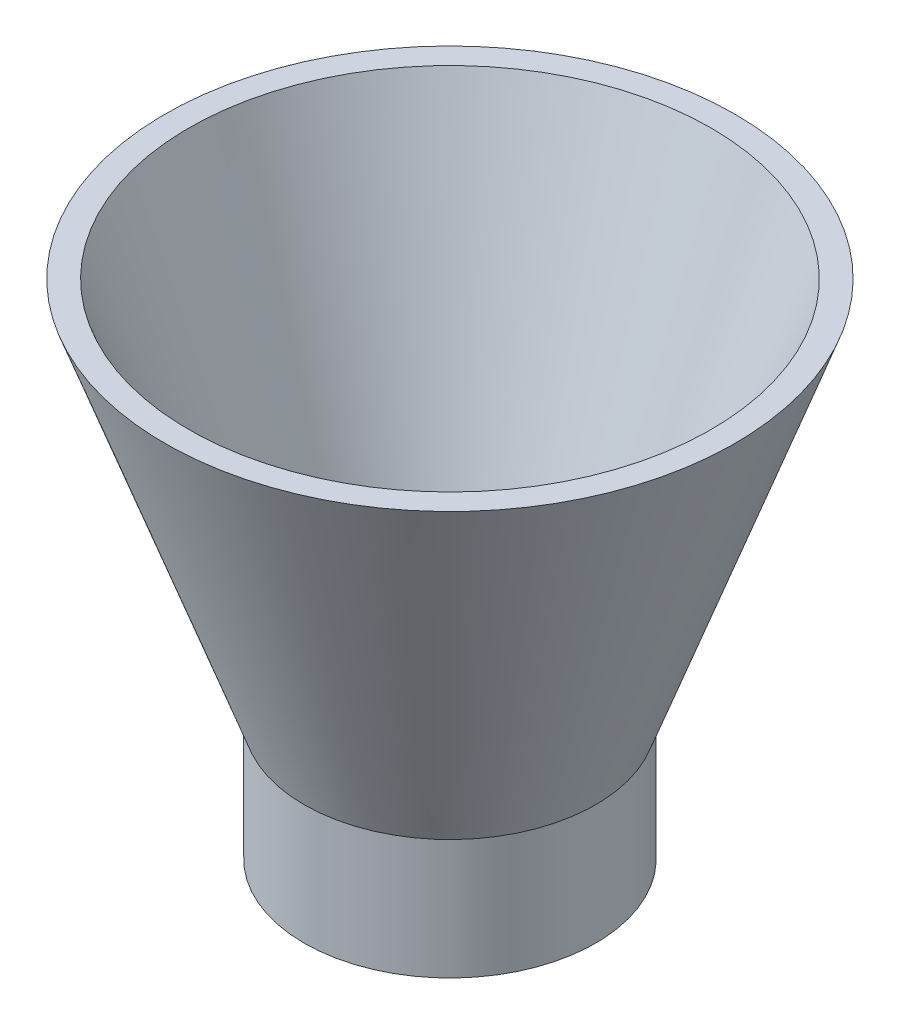
from build123d import *

# Parameters (mm, degrees)
SKETCH1_W = 3.175
SKETCH1_H = 12.7


with BuildPart() as part:
    # Sketch1 → Revolve1 (revolve)
    with BuildSketch(Plane.XY, mode=Mode.PRIVATE) as revolve1_sk:
        Polygon((19.3675, 0), (37.857187901, 50.8), (34.682187901, 50.8), (16.1925, 0), align=None)
        with Locations((17.78, -6.35)):
            Rectangle(SKETCH1_W, SKETCH1_H)
        Polygon((0, -12.7), (16.1925, -12.7), (19.3675, -12.7), (19.3675, -15.920602993), (0, -15.920602993), align=None)
    revolve(revolve1_sk.sketch.rotate(Axis((0, 0, 0), (0, 1, 0)), 90), axis=Axis((0, 0, 0), (0, 1, 0)))


solid = part.part
